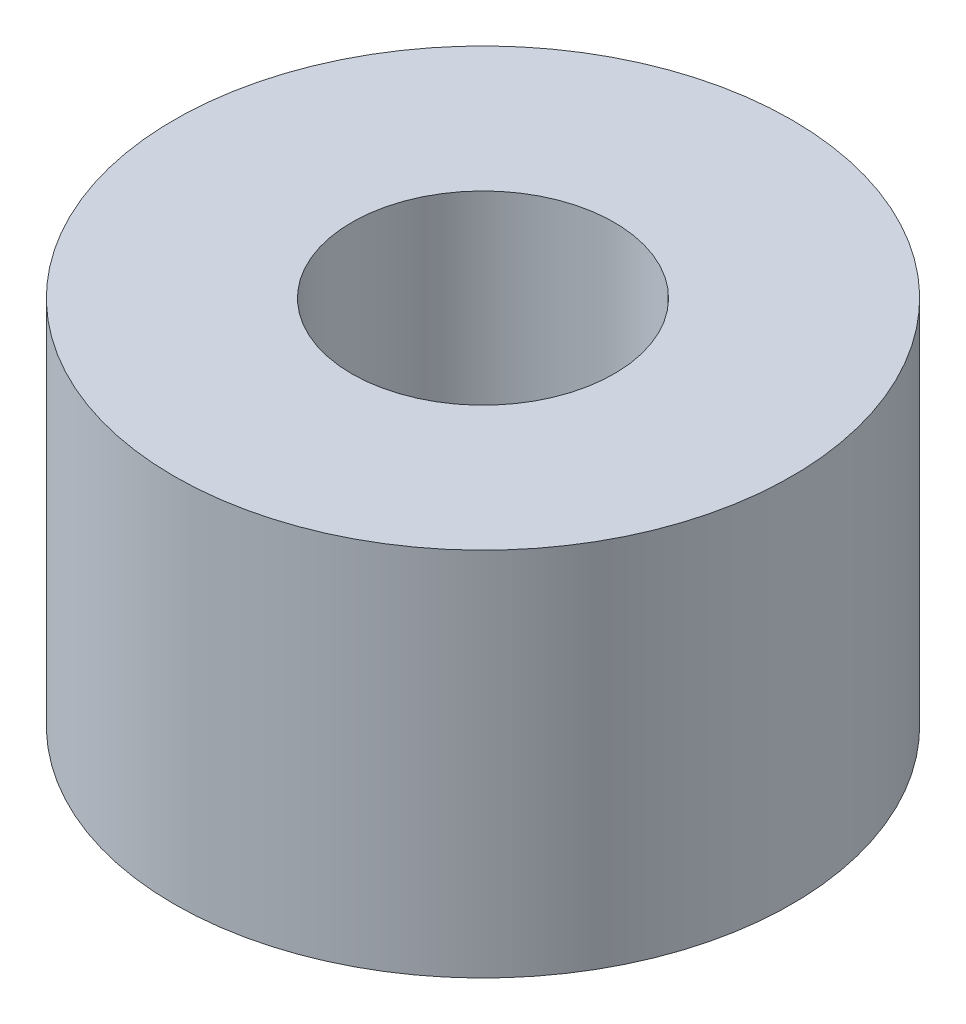
from build123d import *

# Parameters (mm, degrees)
CROQUIS1_R              = 5
CROQUIS1_R_2            = 2.125
SALIENTE_EXTRUIR1_DEPTH = 6


with BuildPart() as part:
    # Croquis1 → Saliente-Extruir1 (new body)
    with BuildSketch(Plane(origin=(0, 0, 0), x_dir=(1, 0, 0), z_dir=(0, 1, 0))):
        with Locations(Location((0, 0, 0), (0, 0, 270))):
            Circle(CROQUIS1_R)
        with Locations(Location((0, 0, 0), (0, 0, 270))):
            Circle(CROQUIS1_R_2, mode=Mode.SUBTRACT)
    extrude(amount=SALIENTE_EXTRUIR1_DEPTH)


solid = part.part
